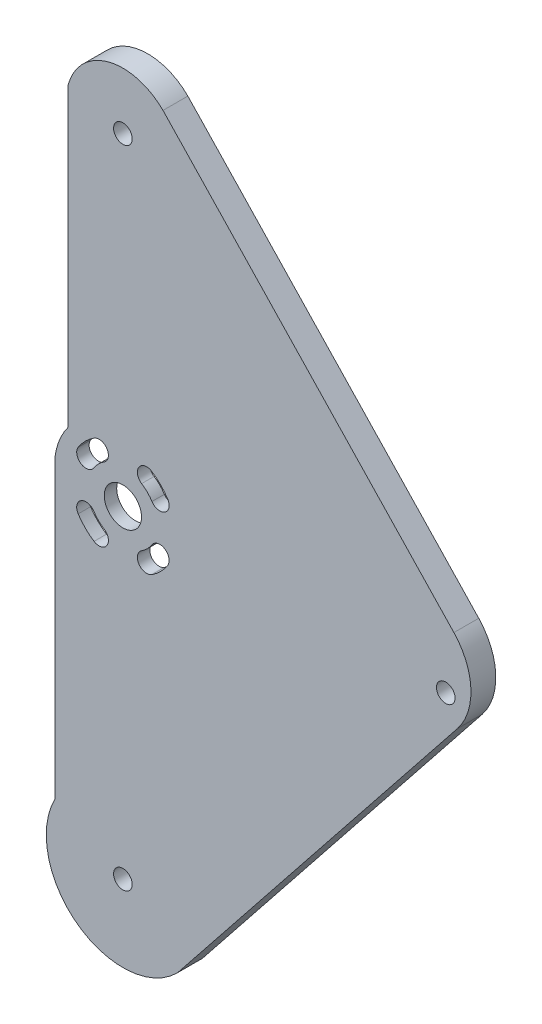
from build123d import *

# Parameters (mm, degrees)
SKETCH_1_R          = 3
SKETCH_1_R_2        = 1.5
EXTRUDE_1_DEPTH     = 4
SKETCH_3_R          = 13
CUT_EXTRUDE_2_DEPTH = 2
FILLET_1_R          = 10


with BuildPart() as part:
    # 草图1 → 凸台-拉伸1 (new body)
    with BuildSketch(Plane.XY):
        with BuildLine():
            Line((1791.975111059, 1614.383538533), (1791.975111059, 1566.628704537))
            ThreePointArc((1791.975111059, 1566.628704537), (1790.596787079, 1564.202595154), (1789.871515189, 1561.508200154))
            Line((1789.871515189, 1561.508200154), (1789.871515189, 1513.753366158))
            ThreePointArc((1789.871515189, 1513.753366158), (1793.527688188, 1498.037586639), (1809.60815907, 1499.368670076))
            Line((1809.60815907, 1499.368670076), (1860.094660389, 1562.753352309))
            Line((1860.094660389, 1562.753352309), (1807.257102758, 1618.471746967))
            ThreePointArc((1807.257102758, 1618.471746967), (1798.436490976, 1620.837124602), (1791.975111059, 1614.383538533))
        make_face()
        with Locations((1800.797367784, 1560.012011993)):
            Circle(SKETCH_1_R, mode=Mode.SUBTRACT)
        with Locations((1800.797367784, 1612.012011993)):
            Circle(SKETCH_1_R_2, mode=Mode.SUBTRACT)
        with Locations((1852.797367784, 1560.012011993)):
            Circle(SKETCH_1_R_2, mode=Mode.SUBTRACT)
        with Locations((1800.797367784, 1508.012011993)):
            Circle(SKETCH_1_R_2, mode=Mode.SUBTRACT)
        with BuildLine():
            ThreePointArc((1805.443255224, 1552.809308797), (1806.858027956, 1553.951351821), (1808.000070981, 1555.366124554))
            ThreePointArc((1808.000070981, 1555.366124554), (1807.55260939, 1557.43971519), (1805.479018754, 1556.992253599))
            ThreePointArc((1805.479018754, 1556.992253599), (1804.736707613, 1556.072672165), (1803.817126178, 1555.330361023))
            ThreePointArc((1803.817126178, 1555.330361023), (1803.369664588, 1553.256770387), (1805.443255224, 1552.809308797))
        make_face(mode=Mode.SUBTRACT)
        with BuildLine():
            ThreePointArc((1808.000070981, 1564.657899433), (1806.858027956, 1566.072672165), (1805.443255224, 1567.21471519))
            ThreePointArc((1805.443255224, 1567.21471519), (1803.369664588, 1566.767253599), (1803.817126178, 1564.693662963))
            ThreePointArc((1803.817126178, 1564.693662963), (1804.736707613, 1563.951351821), (1805.479018754, 1563.031770387))
            ThreePointArc((1805.479018754, 1563.031770387), (1807.55260939, 1562.584308797), (1808.000070981, 1564.657899433))
        make_face(mode=Mode.SUBTRACT)
        with BuildLine():
            ThreePointArc((1796.151480345, 1567.21471519), (1794.736707613, 1566.072672165), (1793.594664588, 1564.657899433))
            ThreePointArc((1793.594664588, 1564.657899433), (1794.042126178, 1562.584308797), (1796.115716814, 1563.031770387))
            ThreePointArc((1796.115716814, 1563.031770387), (1796.858027956, 1563.951351821), (1797.77760939, 1564.693662963))
            ThreePointArc((1797.77760939, 1564.693662963), (1798.225070981, 1566.767253599), (1796.151480345, 1567.21471519))
        make_face(mode=Mode.SUBTRACT)
        with BuildLine():
            ThreePointArc((1793.594664588, 1555.366124554), (1794.736707613, 1553.951351821), (1796.151480345, 1552.809308797))
            ThreePointArc((1796.151480345, 1552.809308797), (1798.225070981, 1553.256770387), (1797.77760939, 1555.330361023))
            ThreePointArc((1797.77760939, 1555.330361023), (1796.858027956, 1556.072672165), (1796.115716814, 1556.992253599))
            ThreePointArc((1796.115716814, 1556.992253599), (1794.042126178, 1557.43971519), (1793.594664588, 1555.366124554))
        make_face(mode=Mode.SUBTRACT)
    extrude(amount=EXTRUDE_1_DEPTH)

    # 草图3 → 切除-拉伸2 (cut)
    with BuildSketch(Plane(origin=(0, 0, 0), x_dir=(-1, 0, 0), z_dir=(0, 0, -1))):
        with Locations((-1800.797367784, 1560.012011993)):
            Circle(SKETCH_3_R)
    extrude(amount=-CUT_EXTRUDE_2_DEPTH, mode=Mode.SUBTRACT)

    # 圆角1
    fillet_1_edges = [part.edges().sort_by_distance(p)[0] for p in [
        (1860.094660389, 1562.753352309, 2),
    ]]
    fillet(fillet_1_edges, radius=FILLET_1_R)


solid = part.part
